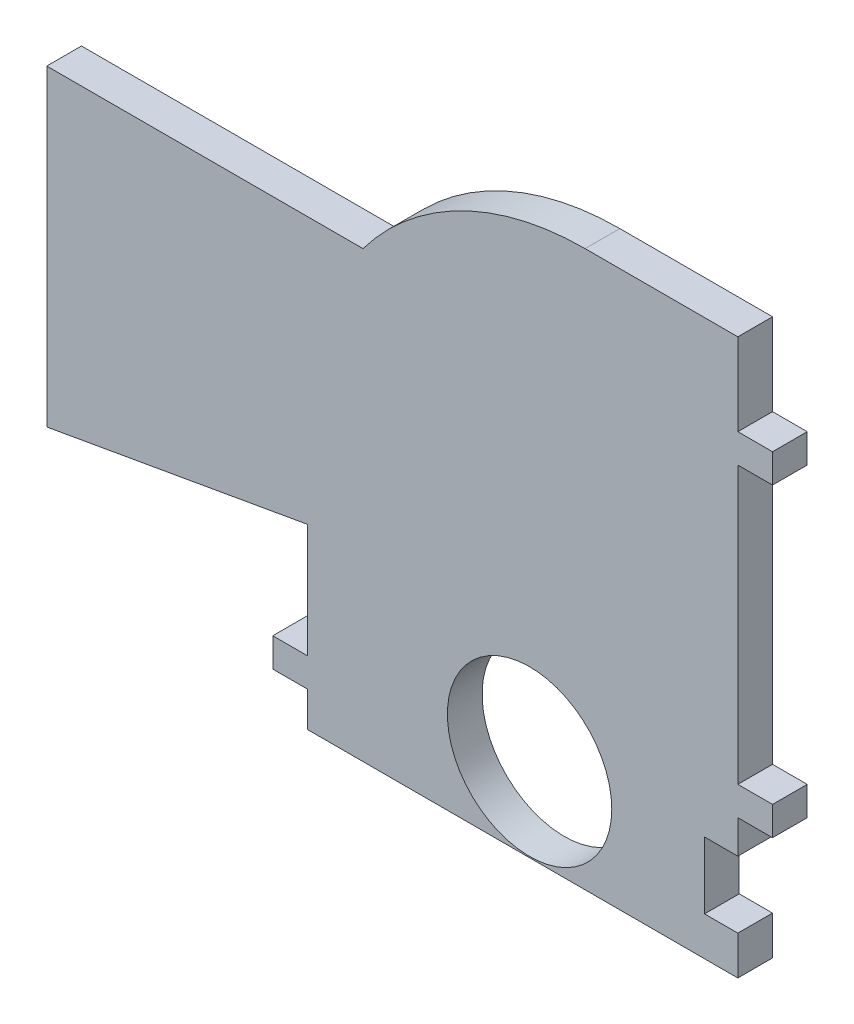
from build123d import *

# Parameters (mm, degrees)
SKETCH1_R           = 3.7592
SKETCH1_W           = 1.5875
SKETCH1_H           = 1.3208
BOSS_EXTRUDE1_DEPTH = 1.5875


with BuildPart() as part:
    # Sketch1 → Boss-Extrude1 (new body)
    # profile 1 of 6: a face of its own
    with BuildSketch(Plane.XY):
        with BuildLine():
            ThreePointArc((2.54, 21.59), (-3.139612663, 20.249225326), (-7.62, 16.51))
            ThreePointArc((-7.62, 16.51), (-9.508277885, 12.906092628), (-10.16, 8.89))
            Line((-10.16, 8.89), (-10.16, 4.318))
            Line((-10.16, 4.318), (-10.16, -0.889))
            Line((-10.16, -0.889), (-10.16, -2.2098))
            Line((-10.16, -2.2098), (-10.16, -3.81))
            Line((-10.16, -3.81), (9.525, -3.81))
            Line((9.525, -3.81), (9.525, -2.032))
            Line((9.525, -2.032), (8.001, -2.032))
            Line((8.001, -2.032), (8.001, 1.016))
            Line((8.001, 1.016), (9.525, 1.016))
            Line((9.525, 1.016), (9.525, 2.54))
            Line((9.525, 2.54), (9.525, 3.8608))
            Line((9.525, 3.8608), (9.525, 16.51))
            Line((9.525, 16.51), (9.525, 17.8308))
            Line((9.525, 17.8308), (9.525, 21.59))
            Line((9.525, 21.59), (2.54, 21.59))
        make_face()
        Circle(SKETCH1_R, mode=Mode.SUBTRACT)
    # profile 2 of 6: a face of its own
    with BuildSketch(Plane.XY):
        with Locations((-10.95375, -1.5494)):
            Rectangle(SKETCH1_W, SKETCH1_H)
    # profile 3 of 6: a face of its own
    with BuildSketch(Plane.XY):
        with Locations((10.31875, 17.1704)):
            Rectangle(SKETCH1_W, SKETCH1_H)
    # profile 4 of 6: a face of its own
    with BuildSketch(Plane.XY):
        with Locations((10.31875, 3.2004)):
            Rectangle(SKETCH1_W, SKETCH1_H)
    # profile 5 of 6: a face of its own
    with BuildSketch(Plane.XY):
        with BuildLine():
            ThreePointArc((-10.16, 8.89), (-9.508277885, 12.906092628), (-7.62, 16.51))
            Line((-7.62, 16.51), (-22.084921519, 16.51))
            Line((-22.084921519, 16.51), (-22.084921519, 13.081))
            Line((-22.084921519, 13.081), (-22.084921519, 4.699))
            Line((-22.084921519, 4.699), (-22.084921519, 2.212007412))
            Line((-22.084921519, 2.212007412), (-10.16, 4.318))
            Line((-10.16, 4.318), (-10.16, 8.89))
        make_face()
    # profile 6 of 6: a face of its own
    with BuildSketch(Plane.XY):
        with BuildLine():
            ThreePointArc((-10.16, 8.89), (-9.508277885, 12.906092628), (-7.62, 16.51))
            Line((-7.62, 16.51), (-22.084921519, 16.51))
            Line((-22.084921519, 16.51), (-22.084921519, 13.081))
            Line((-22.084921519, 13.081), (-22.084921519, 4.699))
            Line((-22.084921519, 4.699), (-22.084921519, 2.212007412))
            Line((-22.084921519, 2.212007412), (-10.16, 4.318))
            Line((-10.16, 4.318), (-10.16, 8.89))
        make_face()
    extrude(amount=BOSS_EXTRUDE1_DEPTH)


solid = part.part
